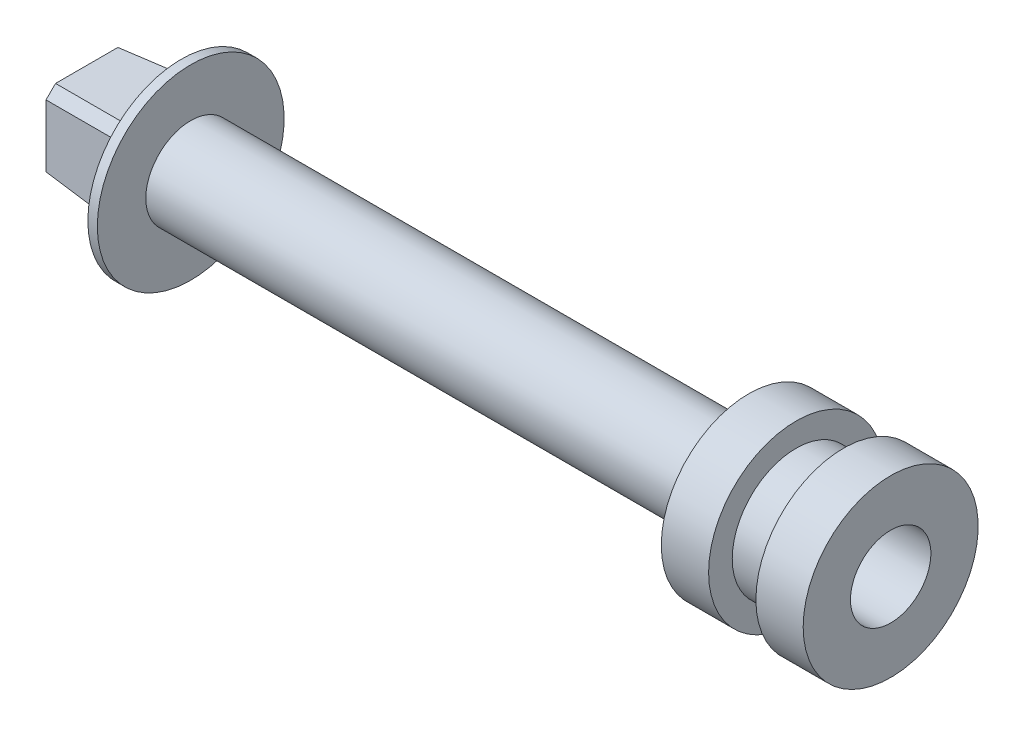
from build123d import *
from OCP.BRepFilletAPI import BRepFilletAPI_MakeChamfer

# Parameters (mm, degrees)
ESQUISSE2_W        = 40
ESQUISSE2_H        = 40
BOSS_EXTRU_1_DEPTH = 40
BOSS_EXTRU_1_TAPER = 4
CHANFREIN1_SIZE    = 4
CHANFREIN1_SIZE2   = 4.019606856


with BuildPart() as part:
    # Esquisse1 → Révolution1 (revolve)
    with BuildSketch(Plane.XY, mode=Mode.PRIVATE) as r_volution1_sk:
        Polygon((0, 0), (0, 39.5), (4, 39.5), (4, 19), (240, 19), (240, 37), (260, 37), (260, 27), (280, 27), (280, 37), (300, 37), (300, 17), (270, 17), (270, 0), align=None)
    revolve(r_volution1_sk.sketch.rotate(Axis((0, 0, 0), (1, 0, 0)), 90), axis=Axis((0, 0, 0), (1, 0, 0)))

    # Esquisse2 → Boss.-Extru.1 (add)
    with BuildSketch(Plane.ZY):
        Rectangle(ESQUISSE2_W, ESQUISSE2_H)
    extrude(amount=BOSS_EXTRU_1_DEPTH, taper=BOSS_EXTRU_1_TAPER)

    # Chanfrein1: one chamfer whose edges measure the first distance from different faces: ONE call of the kernel's chamfer builder (chamfer() names one face for all edges)
    chanfrein1_edges_1 = [part.edges().sort_by_distance(p)[0] for p in [
        (-20, 18.601463761, -18.601463761),
    ]]
    chanfrein1_side_1 = [part.faces().sort_by_distance(p)[0] for p in [
        (-19.498771976, 18.636513039, 0),
    ]]
    chanfrein1_edges_2 = [part.edges().sort_by_distance(p)[0] for p in [
        (-20, -18.601463761, -18.601463761),
    ]]
    chanfrein1_side_2 = [part.faces().sort_by_distance(p)[0] for p in [
        (-19.498771976, 0, -18.636513039),
    ]]
    chanfrein1_edges_3 = [part.edges().sort_by_distance(p)[0] for p in [
        (-20, -18.601463761, 18.601463761),
    ]]
    chanfrein1_side_3 = [part.faces().sort_by_distance(p)[0] for p in [
        (-19.498771976, -18.636513039, 0),
    ]]
    chanfrein1_edges_4 = [part.edges().sort_by_distance(p)[0] for p in [
        (-20, 18.601463761, 18.601463761),
    ]]
    chanfrein1_side_4 = [part.faces().sort_by_distance(p)[0] for p in [
        (-19.498771976, 0, 18.636513039),
    ]]
    chanfrein1 = BRepFilletAPI_MakeChamfer(part.part.solid().wrapped)
    for e in chanfrein1_edges_1:
        chanfrein1.Add(CHANFREIN1_SIZE, CHANFREIN1_SIZE2, e.wrapped, chanfrein1_side_1[0].wrapped)  # the first distance lies on this face
    for e in chanfrein1_edges_2:
        chanfrein1.Add(CHANFREIN1_SIZE, CHANFREIN1_SIZE2, e.wrapped, chanfrein1_side_2[0].wrapped)  # the first distance lies on this face
    for e in chanfrein1_edges_3:
        chanfrein1.Add(CHANFREIN1_SIZE, CHANFREIN1_SIZE2, e.wrapped, chanfrein1_side_3[0].wrapped)  # the first distance lies on this face
    for e in chanfrein1_edges_4:
        chanfrein1.Add(CHANFREIN1_SIZE, CHANFREIN1_SIZE2, e.wrapped, chanfrein1_side_4[0].wrapped)  # the first distance lies on this face
    add(Compound.cast(chanfrein1.Shape()), mode=Mode.REPLACE)


solid = part.part
